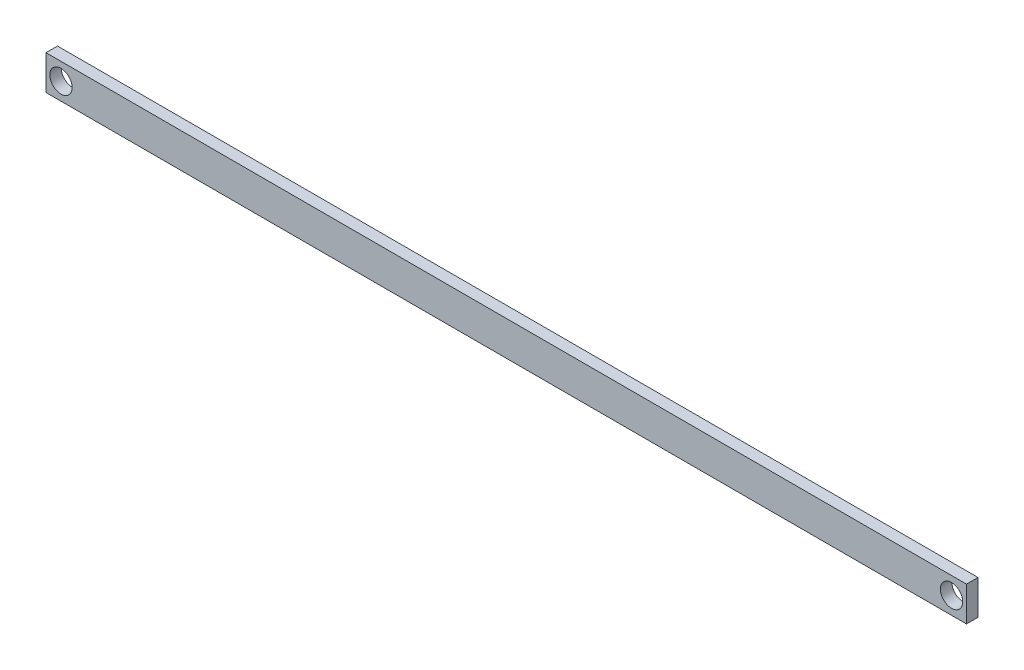
from build123d import *

# Parameters (mm, degrees)
SKETCH2_W           = 400
SKETCH2_H           = 15
BOSS_EXTRUDE1_DEPTH = 5
SKETCH3_R           = 4.85
CUT_EXTRUDE1_DEPTH  = 5


with BuildPart() as part:
    # Sketch2 → Boss-Extrude1 (new body)
    with BuildSketch(Plane.XY):
        with Locations((200, -7.5)):
            Rectangle(SKETCH2_W, SKETCH2_H)
    extrude(amount=-BOSS_EXTRUDE1_DEPTH)

    # Sketch3 → Cut-Extrude1 (cut)
    with BuildSketch(Plane.XY):
        with Locations((6.5, -7.5)):
            Circle(SKETCH3_R)
        with Locations((393.5, -7.5)):
            Circle(SKETCH3_R)
    extrude(amount=-CUT_EXTRUDE1_DEPTH, mode=Mode.SUBTRACT)


solid = part.part
